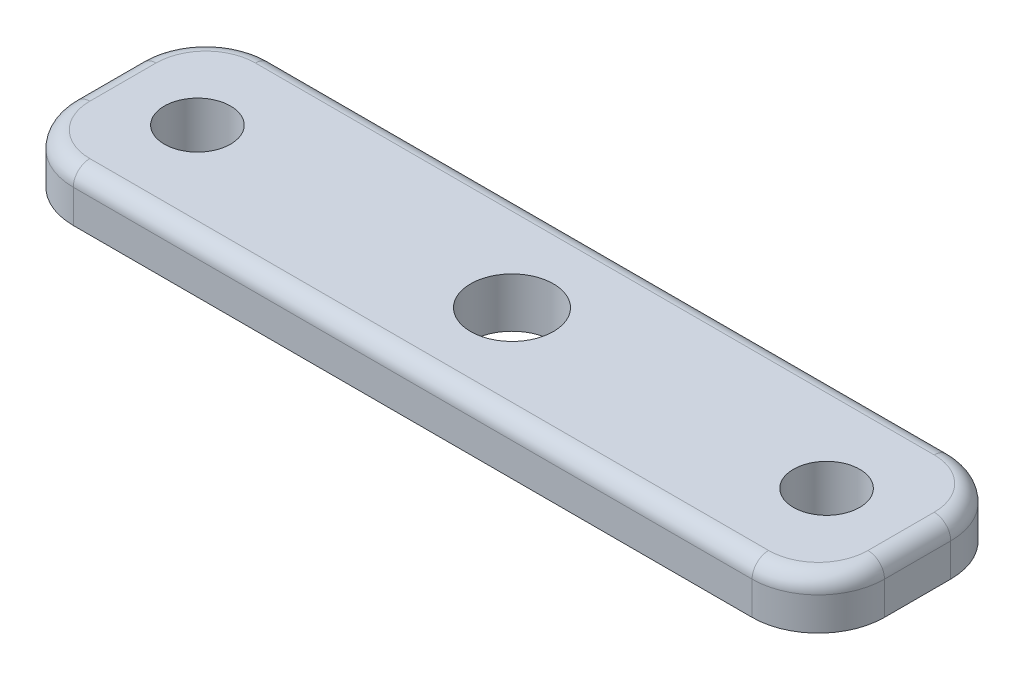
from build123d import *

# Parameters (mm, degrees)
SKETCH1_R           = 2
SKETCH1_R_2         = 2.5
BOSS_EXTRUDE1_DEPTH = 3
FILLET1_R           = 1


with BuildPart() as part:
    # Sketch1 → Boss-Extrude1 (new body)
    with BuildSketch(Plane(origin=(0, 0, 0), x_dir=(1, 0, 0), z_dir=(0, 1, 0))):
        with BuildLine():
            Line((-5.5, 2), (-5.5, -2))
            ThreePointArc((-5.5, -2), (-4.328427125, -4.828427125), (-1.5, -6))
            Line((-1.5, -6), (39.5, -6))
            ThreePointArc((39.5, -6), (42.328427125, -4.828427125), (43.5, -2))
            Line((43.5, -2), (43.5, 2))
            ThreePointArc((43.5, 2), (42.328427125, 4.828427125), (39.5, 6))
            Line((39.5, 6), (-1.5, 6))
            ThreePointArc((-1.5, 6), (-4.328427125, 4.828427125), (-5.5, 2))
        make_face()
        with Locations(Location((0, 0, 0), (0, 0, 270))):
            Circle(SKETCH1_R, mode=Mode.SUBTRACT)
        with Locations(Location((38, 0, 0), (0, 0, 270))):
            Circle(SKETCH1_R, mode=Mode.SUBTRACT)
        with Locations(Location((19.050336346, -0.050336346, 0), (0, 0, 270))):
            Circle(SKETCH1_R_2, mode=Mode.SUBTRACT)
    extrude(amount=BOSS_EXTRUDE1_DEPTH)

    # Fillet1
    fillet1_edges = [part.edges().sort_by_distance(p)[0] for p in [
        (-4.328427125, 3, -4.828427125),
        (-5.5, 3, 0),
        (-4.328427125, 3, 4.828427125),
        (19, 3, 6),
        (42.328427125, 3, 4.828427125),
        (43.5, 3, 0),
        (42.328427125, 3, -4.828427125),
        (19, 3, -6),
    ]]
    fillet(fillet1_edges, radius=FILLET1_R)


solid = part.part
